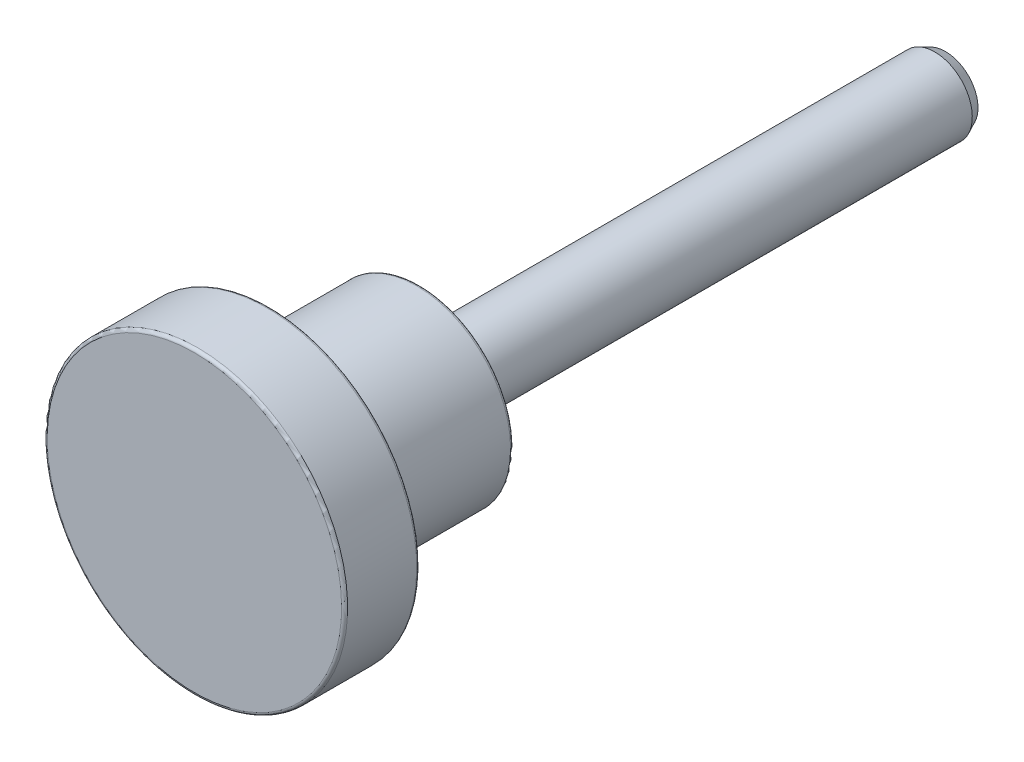
from build123d import *

# Parameters (mm, degrees)
SKETCH1_W = 44.45
SKETCH1_H = 3.175
FILLET1_R = 0.254


with BuildPart() as part:
    # Sketch1 → Revolve1 (revolve)
    with BuildSketch(Plane(origin=(0, 0, 0), x_dir=(0, 0, -1), z_dir=(1, 0, 0))):
        with Locations((0, 1.5875)):
            Rectangle(SKETCH1_W, SKETCH1_H)
    revolve(axis=Axis((0, 0, 8.5598), (0, 0, 1)))

    # Sketch5 → Revolve3 (revolve)
    with BuildSketch(Plane(origin=(0, 0, 0), x_dir=(0, 0, -1), z_dir=(1, 0, 0)), mode=Mode.PRIVATE) as revolve3_sk:
        Polygon((-22.225, 7.9375), (-34.925, 7.9375), (-34.925, 12.7), (-41.275, 12.7), (-41.275, 0), (-22.225, 0), align=None)
    revolve(revolve3_sk.sketch.rotate(Axis((0, 0, 22.225), (0, 0, -1)), 180), axis=Axis((0, 0, 22.225), (0, 0, -1)))

    # Sketch11 → Cut-Revolve4 (revolve, cut)
    with BuildSketch(Plane(origin=(0, 0, 0), x_dir=(0, 0, -1), z_dir=(1, 0, 0)), mode=Mode.PRIVATE) as cut_revolve4_sk:
        Polygon((21.317857143, 3.175), (22.225, 2.751992339), (22.225, 3.175), align=None)
    revolve(cut_revolve4_sk.sketch.rotate(Axis((0, 0, 0), (0, 0, -1)), 180), axis=Axis((0, 0, 0), (0, 0, -1)), mode=Mode.SUBTRACT)

    # Fillet1
    fillet1_edges = [part.edges().sort_by_distance(p)[0] for p in [
        (0, 7.9375, 22.225),
        (0, 12.7, 34.925),
        (0, 12.7, 41.275),
    ]]
    fillet(fillet1_edges, radius=FILLET1_R)


solid = part.part
